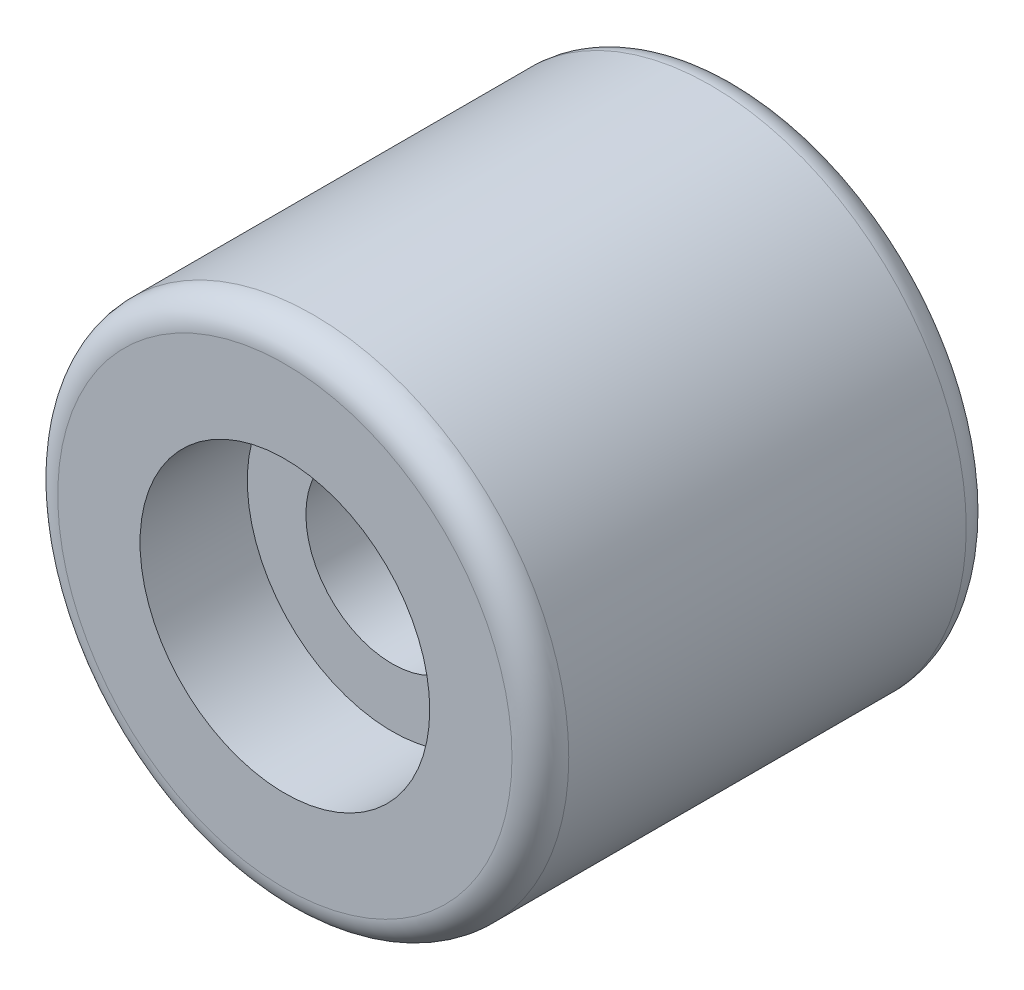
from build123d import *

# Parameters (mm, degrees)
SKETCH1_R           = 7.14375
SKETCH1_R_2         = 2.413
BOSS_EXTRUDE1_DEPTH = 12.7
SKETCH2_R           = 4.05
CUT_EXTRUDE1_DEPTH  = 3
CUT_EXTRUDE2_START  = -3
SKETCH3_R           = 4.05
CUT_EXTRUDE2_DEPTH  = 3
FILLET1_R           = 0.79375


with BuildPart() as part:
    # Sketch1 → Boss-Extrude1 (new body)
    with BuildSketch(Plane.XY):
        Circle(SKETCH1_R)
        Circle(SKETCH1_R_2, mode=Mode.SUBTRACT)
    extrude(amount=BOSS_EXTRUDE1_DEPTH)

    # Sketch2 → Cut-Extrude1 (cut)
    with BuildSketch(Plane.XY.offset(12.7)):
        Circle(SKETCH2_R)
    extrude(amount=-CUT_EXTRUDE1_DEPTH, mode=Mode.SUBTRACT)

    # Sketch3 → Cut-Extrude2 (cut)
    with BuildSketch(Plane(origin=(0, 0, 0), x_dir=(-1, 0, 0), z_dir=(0, 0, -1)).offset(CUT_EXTRUDE2_START)):
        with Locations(Location((0, 0, 0), (0, 0, 180))):
            Circle(SKETCH3_R)
    extrude(amount=CUT_EXTRUDE2_DEPTH, mode=Mode.SUBTRACT)

    # Fillet1
    fillet1_edges = [part.edges().sort_by_distance(p)[0] for p in [
        (-7.14375, 0, 0),
        (-7.14375, 0, 12.7),
    ]]
    fillet(fillet1_edges, radius=FILLET1_R)


solid = part.part
